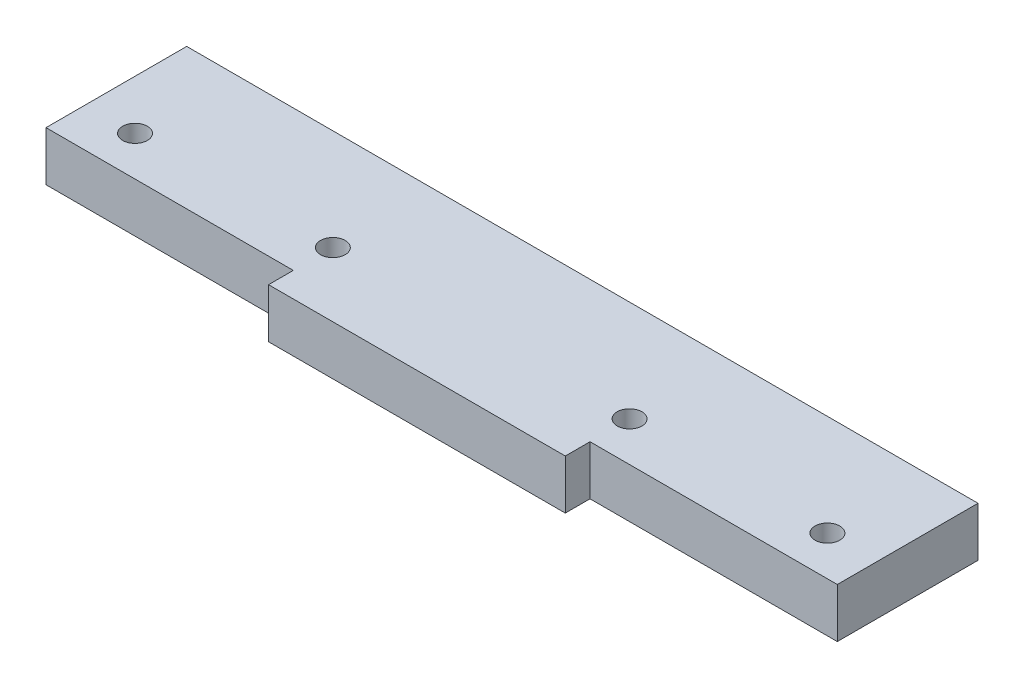
from build123d import *

# Parameters (mm, degrees)
SKETCH2_W           = 160
SKETCH2_H           = 28.45
BOSS_EXTRUDE1_DEPTH = 10
SKETCH4_W           = 60
SKETCH4_H           = 10
BOSS_EXTRUDE2_DEPTH = 5
SKETCH5_R           = 2.5
CUT_EXTRUDE1_DEPTH  = 83.883053907


with BuildPart() as part:
    # Sketch2 → Boss-Extrude1 (new body)
    with BuildSketch(Plane(origin=(0, 0, 0), x_dir=(1, 0, 0), z_dir=(0, 1, 0))):
        Rectangle(SKETCH2_W, SKETCH2_H)
    extrude(amount=BOSS_EXTRUDE1_DEPTH)

    # Sketch4 → Boss-Extrude2 (add)
    with BuildSketch(Plane.XY.offset(14.225)):
        with Locations((0, 5)):
            Rectangle(SKETCH4_W, SKETCH4_H)
    extrude(amount=BOSS_EXTRUDE2_DEPTH)

    # Sketch5 → Cut-Extrude1 (cut, through all)
    with BuildSketch(Plane(origin=(0, 10, 0), x_dir=(1, 0, 0), z_dir=(0, 1, 0))):
        with Locations(Location((70, -6.225, 0), (0, 0, 270))):
            Circle(SKETCH5_R)
        with Locations(Location((30, -6.225, 0), (0, 0, 270))):
            Circle(SKETCH5_R)
        with Locations(Location((-30, -6.225, 0), (0, 0, 90))):
            Circle(SKETCH5_R)
        with Locations(Location((-70, -6.225, 0), (0, 0, 90))):
            Circle(SKETCH5_R)
    extrude(amount=-CUT_EXTRUDE1_DEPTH, mode=Mode.SUBTRACT)


solid = part.part
